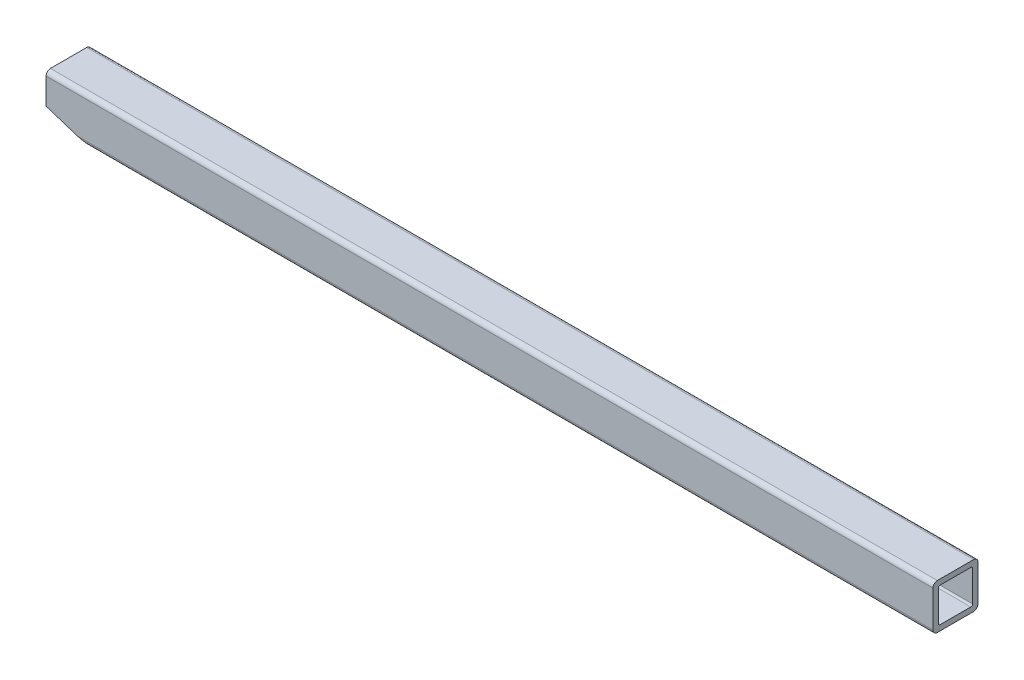
from build123d import *

# Parameters (mm, degrees)
SKETCH3_W           = 25.4
SKETCH3_H           = 25.4
SKETCH3_W_2         = 19.304
SKETCH3_H_2         = 19.304
BOSS_EXTRUDE1_DEPTH = 500
FILLET1_R           = 2.5
FILLET2_R           = 1
CUT_EXTRUDE1_DEPTH  = 501.805800685


with BuildPart() as part:
    # Sketch3 → Boss-Extrude1 (new body)
    with BuildSketch(Plane(origin=(0, 0, 0), x_dir=(0, 0, -1), z_dir=(1, 0, 0))):
        Rectangle(SKETCH3_W, SKETCH3_H)
        Rectangle(SKETCH3_W_2, SKETCH3_H_2, mode=Mode.SUBTRACT)
    extrude(amount=-BOSS_EXTRUDE1_DEPTH)

    # Fillet1
    fillet1_edges = [part.edges().sort_by_distance(p)[0] for p in [
        (-250, -12.7, -12.7),
        (-250, -12.7, 12.7),
        (-250, 12.7, 12.7),
        (-250, 12.7, -12.7),
    ]]
    fillet(fillet1_edges, radius=FILLET1_R)

    # Fillet2
    fillet2_edges = [part.edges().sort_by_distance(p)[0] for p in [
        (-250, 9.652, -9.652),
        (-250, -9.652, -9.652),
        (-250, -9.652, 9.652),
        (-250, 9.652, 9.652),
    ]]
    fillet(fillet2_edges, radius=FILLET2_R)

    # Sketch4 → Cut-Extrude1 (cut, through all)
    with BuildSketch(Plane.XY.offset(12.7)):
        Polygon((-482.303319661, -10.2), (-500, -4.45), (-500, -10.2), align=None)
        Polygon((-474.609110818, -12.7), (-482.303319661, -10.2), (-500, -10.2), (-500, -12.7), align=None)
    extrude(amount=-CUT_EXTRUDE1_DEPTH, mode=Mode.SUBTRACT)


solid = part.part
